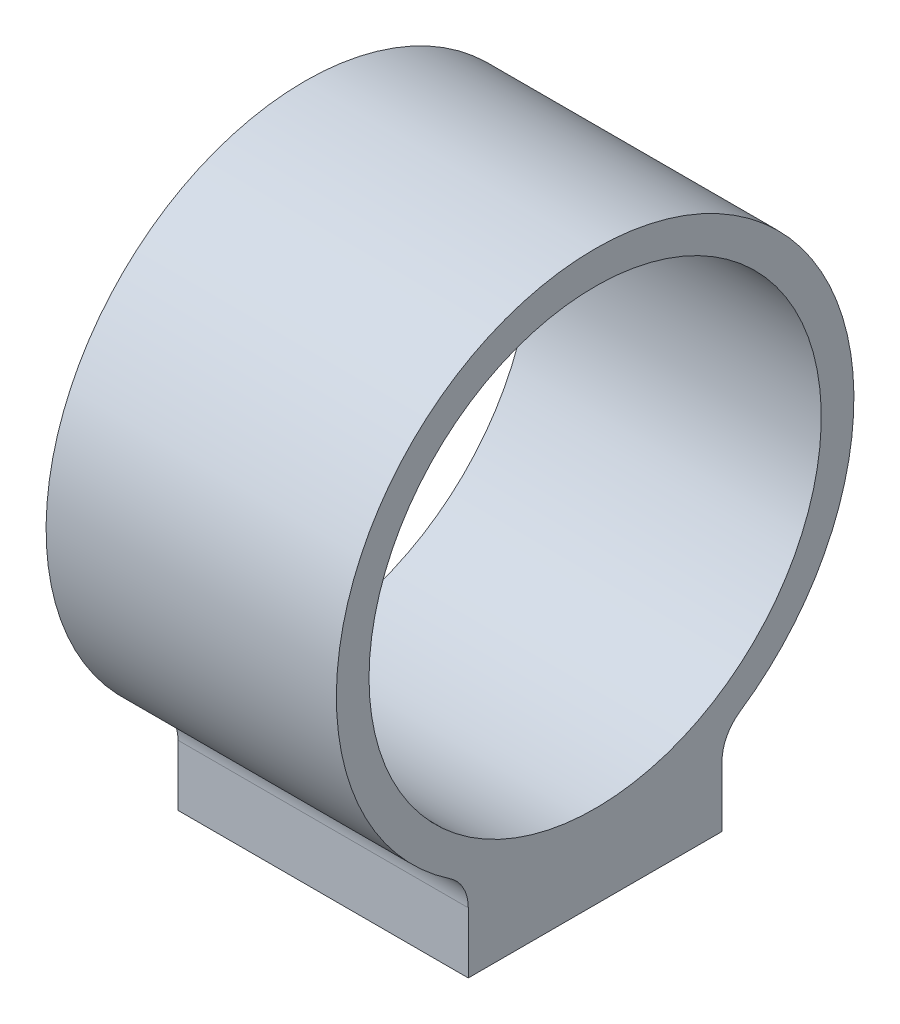
from build123d import *

# Parameters (mm, degrees)
SKETCH1_W           = 17.78
SKETCH1_H           = 15.54
BOSS_EXTRUDE1_DEPTH = 3.1
SKETCH3_R           = 13.85
BOSS_EXTRUDE2_DEPTH = 17.78
FILLET1_R           = 2.54


with BuildPart() as part:
    # Sketch1 → Boss-Extrude1 (new body)
    with BuildSketch(Plane(origin=(0, 0, 0), x_dir=(1, 0, 0), z_dir=(0, 1, 0))):
        with Locations((8.89, 7.77)):
            Rectangle(SKETCH1_W, SKETCH1_H)
    extrude(amount=BOSS_EXTRUDE1_DEPTH)

    # Sketch3 → Boss-Extrude2 (add)
    with BuildSketch(Plane.ZY):
        with BuildLine():
            Line((-15.54, 3.1), (-15.54, 5.135167392))
            ThreePointArc((-15.54, 5.135167392), (-7.77, 34.8), (0, 5.135167392))
            Line((0, 5.135167392), (0, 3.1))
            Line((0, 3.1), (-15.54, 3.1))
        make_face()
        with Locations((-7.77, 18.95)):
            Circle(SKETCH3_R, mode=Mode.SUBTRACT)
    extrude(amount=-BOSS_EXTRUDE2_DEPTH)

    # Fillet1
    fillet1_edges = [part.edges().sort_by_distance(p)[0] for p in [
        (8.89, 5.135167392, 0),
        (8.89, 5.135167392, -15.54),
    ]]
    fillet(fillet1_edges, radius=FILLET1_R)


solid = part.part
